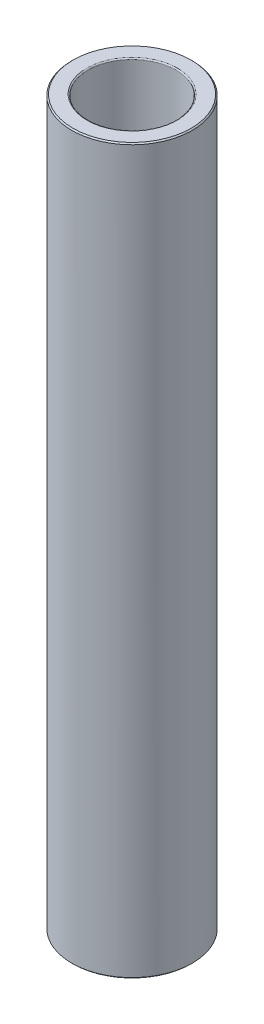
from build123d import *

# Parameters (mm, degrees)
SKETCH1_R           = 12.7
SKETCH1_R_2         = 9.271
BOSS_EXTRUDE1_DEPTH = 152.4
CHAMFER1_SIZE       = 0.254
FILLET1_R           = 0.254


with BuildPart() as part:
    # Sketch1 → Boss-Extrude1 (new body)
    with BuildSketch(Plane(origin=(0, 0, 0), x_dir=(1, 0, 0), z_dir=(0, 1, 0))):
        with Locations(Location((0, 0, 0), (0, 0, 90))):
            Circle(SKETCH1_R)
        with Locations(Location((0, 0, 0), (0, 0, 90))):
            Circle(SKETCH1_R_2, mode=Mode.SUBTRACT)
    extrude(amount=BOSS_EXTRUDE1_DEPTH)

    # Chamfer1
    chamfer1_edges = [part.edges().sort_by_distance(p)[0] for p in [
        (0, 0, 12.7),
        (0, 152.4, 12.7),
    ]]
    chamfer(chamfer1_edges, length=CHAMFER1_SIZE)

    # Fillet1
    fillet1_edges = [part.edges().sort_by_distance(p)[0] for p in [
        (0, 0, 9.271),
        (0, 152.4, 9.271),
    ]]
    fillet(fillet1_edges, radius=FILLET1_R)


solid = part.part
